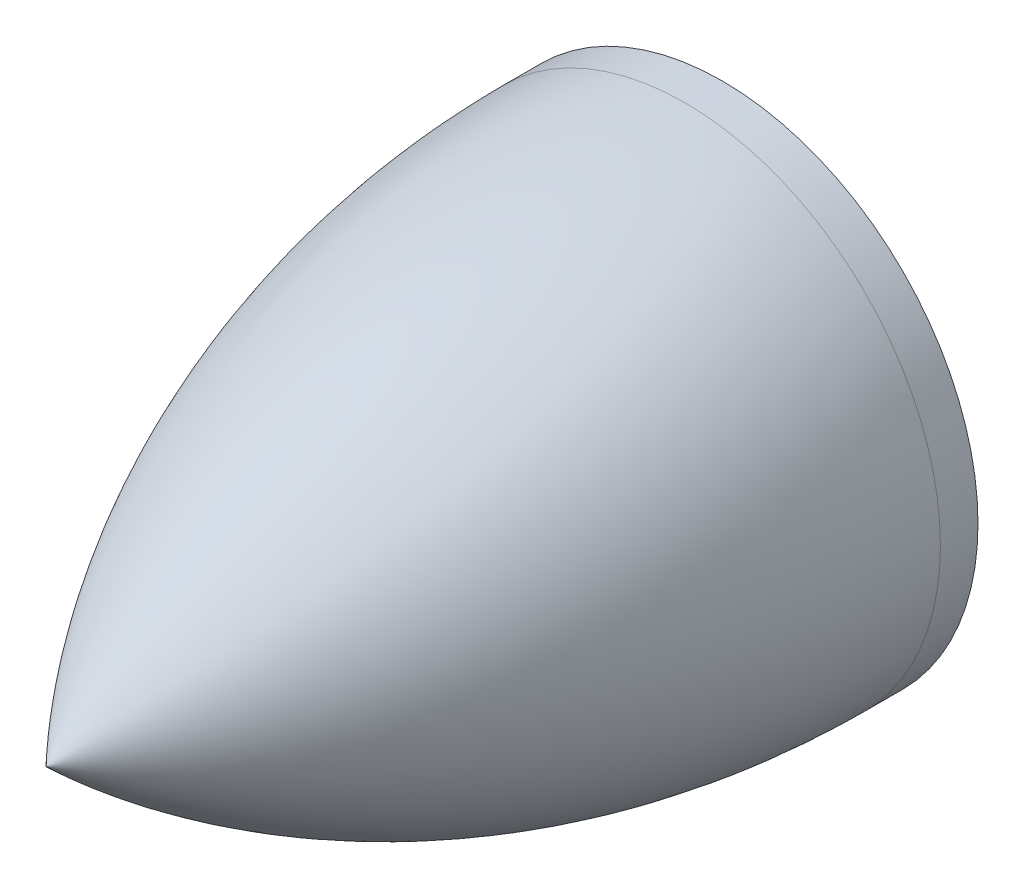
from build123d import *

# Parameters (mm, degrees)
SKETCH3_R           = 68
SKETCH3_R_2         = 66.25
BOSS_EXTRUDE1_DEPTH = 10


with BuildPart() as part:
    # Sketch2 → Revolve1 (revolve)
    with BuildSketch(Plane(origin=(0, 0, 0), x_dir=(0, 0, -1), z_dir=(1, 0, 0))):
        with BuildLine():
            ThreePointArc((-162.665300541, 178.5), (-87.219550561, 225.19991119), (0, 241.5))
            Line((0, 241.5), (0, 246.5))
            ThreePointArc((0, 246.5), (-91.547801721, 228.869504303), (-170, 178.5))
            Line((-170, 178.5), (-165, 178.5))
            Line((-165, 178.5), (-162.665300541, 178.5))
        make_face()
    revolve(axis=Axis((0, 178.5, 397.764697407), (0, 0, -1)))

    # Sketch3 → Boss-Extrude1 (add)
    with BuildSketch(Plane(origin=(0, 0, 0), x_dir=(-1, 0, 0), z_dir=(0, 0, -1))):
        with Locations(Location((0, 178.5, 0), (0, 0, 180))):
            Circle(SKETCH3_R)
        with Locations(Location((0, 178.5, 0), (0, 0, 180))):
            Circle(SKETCH3_R_2, mode=Mode.SUBTRACT)
    extrude(amount=BOSS_EXTRUDE1_DEPTH)


solid = part.part
